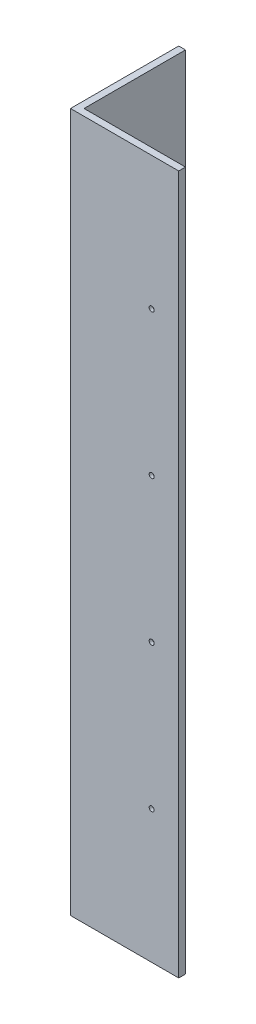
from build123d import *

# Parameters (mm, degrees)
SKETCH2_W                                           = 152.4
SKETCH2_H                                           = 984.25
BOSS_EXTRUDE1_DEPTH                                 = 9.525
SKETCH4_W                                           = 142.875
SKETCH4_H                                           = 984.25
BOSS_EXTRUDE2_DEPTH                                 = 9.525
SKETCH5_R                                           = 3.5687
CUT_EXTRUDE1_DEPTH                                  = 9.525
SKETCH6_R                                           = 3.5687
CUT_EXTRUDE2_DEPTH                                  = 9.525
CSK_FOR_1_4_FLAT_HEAD_MACHINE_SCREW1_D              = 6.7564
CSK_FOR_1_4_FLAT_HEAD_MACHINE_SCREW1_CSINK_D        = 15.5273756
CSK_FOR_1_4_FLAT_HEAD_MACHINE_SCREW1_CSINK_ANGLE    = 82
CSK_FOR_1_4_FLAT_HEAD_MACHINE_SCREW2_D              = 6.7564
CSK_FOR_1_4_FLAT_HEAD_MACHINE_SCREW2_CSINK_D        = 15.5273756
CSK_FOR_1_4_FLAT_HEAD_MACHINE_SCREW2_CSINK_ANGLE    = 82
CSK_FOR_1_4_FLAT_HEAD_MACHINE_SCREW_100_D           = 6.7564
CSK_FOR_1_4_FLAT_HEAD_MACHINE_SCREW_100_CSINK_D     = 16.510254
CSK_FOR_1_4_FLAT_HEAD_MACHINE_SCREW_100_CSINK_ANGLE = 100
CSK_FOR_1_4_FLAT_HEAD_MACHINE_SCREW5_D              = 6.7564
CSK_FOR_1_4_FLAT_HEAD_MACHINE_SCREW5_CSINK_D        = 15.5273756
CSK_FOR_1_4_FLAT_HEAD_MACHINE_SCREW5_CSINK_ANGLE    = 82
CSK_FOR_1_4_FLAT_HEAD_MACHINE_SCREW6_D              = 6.7564
CSK_FOR_1_4_FLAT_HEAD_MACHINE_SCREW6_CSINK_D        = 15.5273756
CSK_FOR_1_4_FLAT_HEAD_MACHINE_SCREW6_CSINK_ANGLE    = 82
CSK_FOR_1_4_FLAT_HEAD_MACHINE_SCREW7_D              = 6.7564
CSK_FOR_1_4_FLAT_HEAD_MACHINE_SCREW7_CSINK_D        = 15.5273756
CSK_FOR_1_4_FLAT_HEAD_MACHINE_SCREW7_CSINK_ANGLE    = 82
CSK_FOR_1_4_FLAT_HEAD_MACHINE_SCREW8_D              = 6.7564
CSK_FOR_1_4_FLAT_HEAD_MACHINE_SCREW8_CSINK_D        = 15.5273756
CSK_FOR_1_4_FLAT_HEAD_MACHINE_SCREW8_CSINK_ANGLE    = 82
CSK_FOR_1_4_FLAT_HEAD_MACHINE_SCREW4_D              = 6.7564
CSK_FOR_1_4_FLAT_HEAD_MACHINE_SCREW4_CSINK_D        = 15.5273756
CSK_FOR_1_4_FLAT_HEAD_MACHINE_SCREW4_CSINK_ANGLE    = 82


with BuildPart() as part:
    # Sketch2 → Boss-Extrude1 (new body)
    with BuildSketch(Plane.XY):
        with Locations((7.535690004, -455.883176253)):
            Rectangle(SKETCH2_W, SKETCH2_H)
    extrude(amount=BOSS_EXTRUDE1_DEPTH)

    # Sketch4 → Boss-Extrude2 (add)
    with BuildSketch(Plane.ZY.offset(68.664309996)):
        with Locations((-71.4375, -455.883176253)):
            Rectangle(SKETCH4_W, SKETCH4_H)
    extrude(amount=-BOSS_EXTRUDE2_DEPTH)

    # Sketch5 → Cut-Extrude1 (cut)
    with BuildSketch(Plane.ZY.offset(68.664309996)):
        with Locations((-104.775, -151.083176253)):
            Circle(SKETCH5_R)
        with Locations((-104.775, -354.283176253)):
            Circle(SKETCH5_R)
        with Locations((-104.775, -557.483176253)):
            Circle(SKETCH5_R)
        with Locations((-104.775, -760.683176253)):
            Circle(SKETCH5_R)
    extrude(amount=-CUT_EXTRUDE1_DEPTH, mode=Mode.SUBTRACT)

    # Sketch6 → Cut-Extrude2 (cut)
    with BuildSketch(Plane.XY.offset(9.525)):
        with Locations((45.635690004, -151.083176253)):
            Circle(SKETCH6_R)
        with Locations((45.635690004, -354.283176253)):
            Circle(SKETCH6_R)
        with Locations((45.635690004, -557.483176253)):
            Circle(SKETCH6_R)
        with Locations((45.635690004, -760.683176253)):
            Circle(SKETCH6_R)
    extrude(amount=-CUT_EXTRUDE2_DEPTH, mode=Mode.SUBTRACT)

    # CSK for 1/4 Flat Head Machine Screw1 (through all)
    with Locations(Plane(origin=(-59.139309996, -151.083176253, -104.775), x_dir=(0, 0, 1), z_dir=(1, 0, 0))):
        with Locations((0, 0)):
            CounterSinkHole(CSK_FOR_1_4_FLAT_HEAD_MACHINE_SCREW1_D / 2, CSK_FOR_1_4_FLAT_HEAD_MACHINE_SCREW1_CSINK_D / 2, counter_sink_angle=CSK_FOR_1_4_FLAT_HEAD_MACHINE_SCREW1_CSINK_ANGLE)

    # CSK for 1/4 Flat Head Machine Screw2 (through all)
    with Locations(Plane(origin=(-59.139309996, -354.283176253, -104.775), x_dir=(0, 0, 1), z_dir=(1, 0, 0))):
        with Locations((0, 0)):
            CounterSinkHole(CSK_FOR_1_4_FLAT_HEAD_MACHINE_SCREW2_D / 2, CSK_FOR_1_4_FLAT_HEAD_MACHINE_SCREW2_CSINK_D / 2, counter_sink_angle=CSK_FOR_1_4_FLAT_HEAD_MACHINE_SCREW2_CSINK_ANGLE)

    # CSK for 1/4 Flat Head Machine Screw (100)4 (through all)
    with Locations(Plane(origin=(-59.139309996, -760.683176253, -104.775), x_dir=(0, 0, 1), z_dir=(1, 0, 0))):
        with Locations((0, 0)):
            CounterSinkHole(CSK_FOR_1_4_FLAT_HEAD_MACHINE_SCREW_100_D / 2, CSK_FOR_1_4_FLAT_HEAD_MACHINE_SCREW_100_CSINK_D / 2, counter_sink_angle=CSK_FOR_1_4_FLAT_HEAD_MACHINE_SCREW_100_CSINK_ANGLE)

    # CSK for 1/4 Flat Head Machine Screw5 (through all)
    with Locations(Plane(origin=(45.635690004, -151.083176253, 0), x_dir=(-1, 0, 0), z_dir=(0, 0, -1))):
        with Locations((0, 0)):
            CounterSinkHole(CSK_FOR_1_4_FLAT_HEAD_MACHINE_SCREW5_D / 2, CSK_FOR_1_4_FLAT_HEAD_MACHINE_SCREW5_CSINK_D / 2, counter_sink_angle=CSK_FOR_1_4_FLAT_HEAD_MACHINE_SCREW5_CSINK_ANGLE)

    # CSK for 1/4 Flat Head Machine Screw6 (through all)
    with Locations(Plane(origin=(45.635690004, -354.283176253, 0), x_dir=(-1, 0, 0), z_dir=(0, 0, -1))):
        with Locations((0, 0)):
            CounterSinkHole(CSK_FOR_1_4_FLAT_HEAD_MACHINE_SCREW6_D / 2, CSK_FOR_1_4_FLAT_HEAD_MACHINE_SCREW6_CSINK_D / 2, counter_sink_angle=CSK_FOR_1_4_FLAT_HEAD_MACHINE_SCREW6_CSINK_ANGLE)

    # CSK for 1/4 Flat Head Machine Screw7 (through all)
    with Locations(Plane(origin=(45.635690004, -557.483176253, 0), x_dir=(-1, 0, 0), z_dir=(0, 0, -1))):
        with Locations((0, 0)):
            CounterSinkHole(CSK_FOR_1_4_FLAT_HEAD_MACHINE_SCREW7_D / 2, CSK_FOR_1_4_FLAT_HEAD_MACHINE_SCREW7_CSINK_D / 2, counter_sink_angle=CSK_FOR_1_4_FLAT_HEAD_MACHINE_SCREW7_CSINK_ANGLE)

    # CSK for 1/4 Flat Head Machine Screw8 (through all)
    with Locations(Plane(origin=(45.635690004, -760.683176253, 0), x_dir=(-1, 0, 0), z_dir=(0, 0, -1))):
        with Locations((0, 0)):
            CounterSinkHole(CSK_FOR_1_4_FLAT_HEAD_MACHINE_SCREW8_D / 2, CSK_FOR_1_4_FLAT_HEAD_MACHINE_SCREW8_CSINK_D / 2, counter_sink_angle=CSK_FOR_1_4_FLAT_HEAD_MACHINE_SCREW8_CSINK_ANGLE)

    # CSK for 1/4 Flat Head Machine Screw4 (through all)
    with Locations(Plane(origin=(-59.139309996, -557.483176253, -104.775), x_dir=(0, 0, 1), z_dir=(1, 0, 0))):
        with Locations((0, 0)):
            CounterSinkHole(CSK_FOR_1_4_FLAT_HEAD_MACHINE_SCREW4_D / 2, CSK_FOR_1_4_FLAT_HEAD_MACHINE_SCREW4_CSINK_D / 2, counter_sink_angle=CSK_FOR_1_4_FLAT_HEAD_MACHINE_SCREW4_CSINK_ANGLE)


solid = part.part
